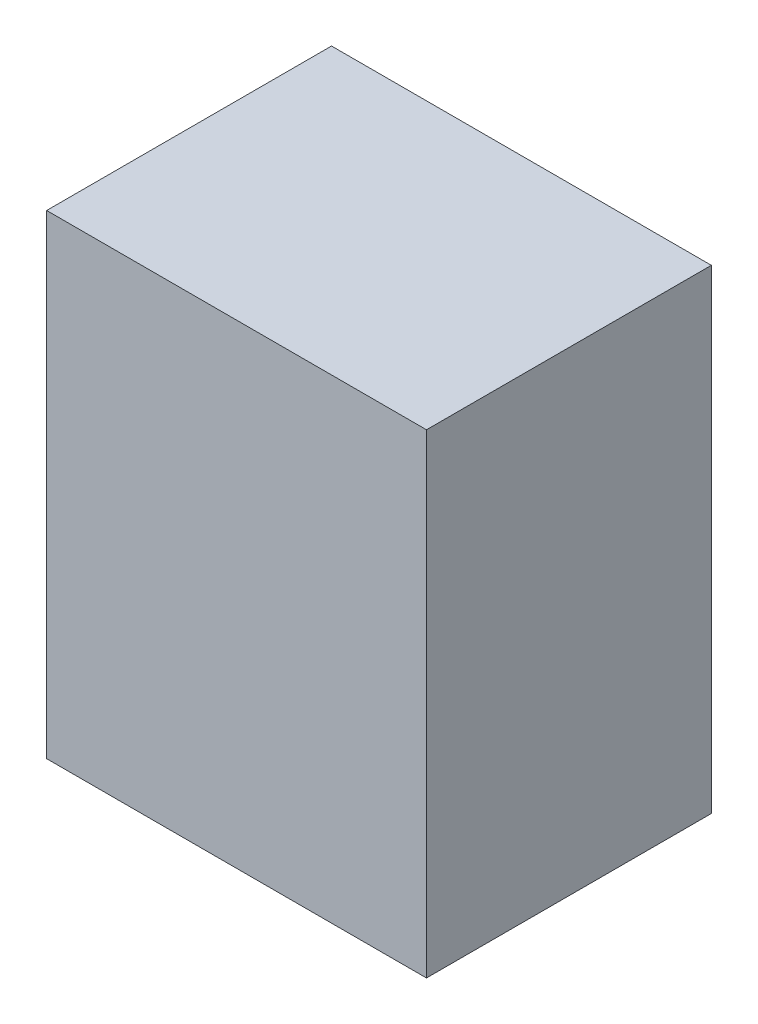
from build123d import *

# Parameters (mm, degrees)
SKETCH1_W     = 8
SKETCH1_H     = 10
PROFILE_DEPTH = 6


with BuildPart() as part:
    # Sketch1 → Profile (new body)
    with BuildSketch(Plane.XY):
        with Locations((4, 5)):
            Rectangle(SKETCH1_W, SKETCH1_H)
    extrude(amount=PROFILE_DEPTH)


solid = part.part
